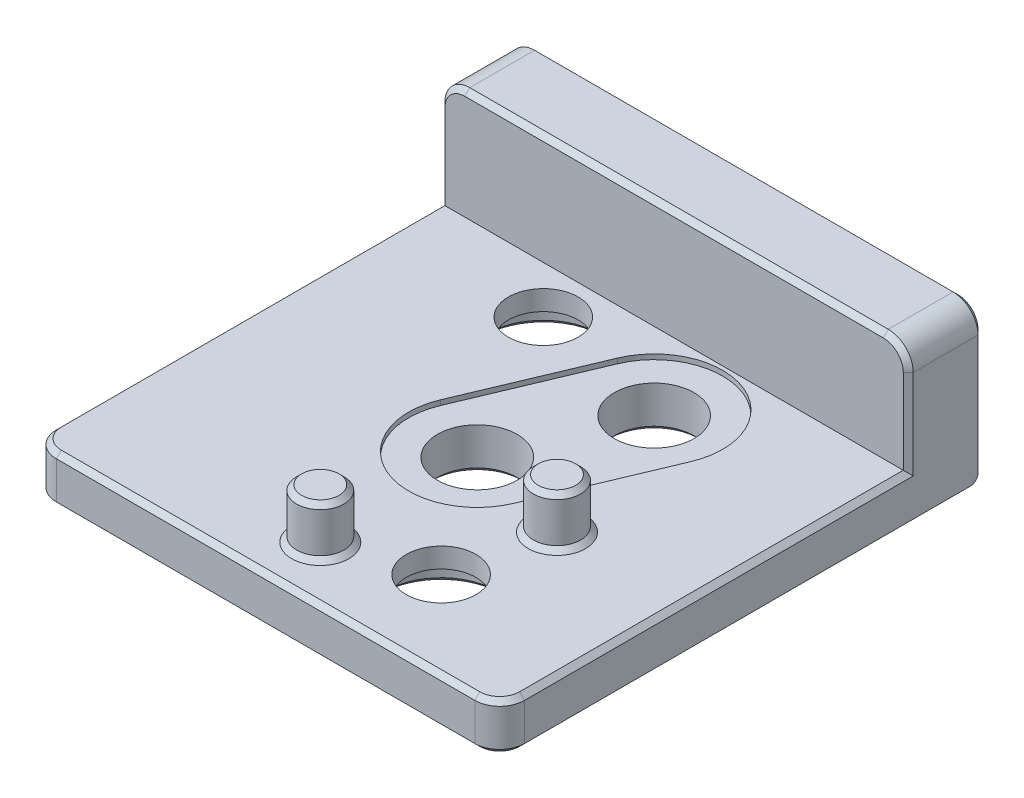
from build123d import *

# Parameters (mm, degrees)
SKETCH1_W           = 19.4
SKETCH1_H           = 1.9
SKETCH1_W_2         = 3
SKETCH1_H_2         = 4.4
BOSS_EXTRUDE1_DEPTH = 9.4
SKETCH2_R           = 1.6
SKETCH2_R_2         = 1.4
CUT_EXTRUDE1_DEPTH  = 23.001818107
CUT_EXTRUDE2_DEPTH  = 0.2
SKETCH4_R           = 2.25
CUT_EXTRUDE3_DEPTH  = 1.1
FILLET1_R           = 1
SKETCH5_R           = 0.95
BOSS_EXTRUDE2_DEPTH = 2
FILLET4_R           = 0.5
CHAMFER1_SIZE       = 0.2


with BuildPart() as part:
    # Sketch1 → Boss-Extrude1 (new, symmetric)
    with BuildSketch(Plane(origin=(0, 0, 0), x_dir=(0, 0, -1), z_dir=(1, 0, 0))):
        with Locations((9.7, -0.95)):
            Rectangle(SKETCH1_W, SKETCH1_H)
        with Locations((17.9, 2.2)):
            Rectangle(SKETCH1_W_2, SKETCH1_H_2)
    extrude(amount=BOSS_EXTRUDE1_DEPTH, both=True)

    # Sketch2 → Cut-Extrude1 (cut, through all)
    with BuildSketch(Plane(origin=(0, 0, 0), x_dir=(1, 0, 0), z_dir=(0, 1, 0))):
        with Locations(Location((0, 8.5, 0), (0, 0, 270))):
            Circle(SKETCH2_R)
        with Locations(Location((2.1, 13.5, 0), (0, 0, 270))):
            Circle(SKETCH2_R)
        with Locations(Location((3.55, 3.5, 0), (0, 0, 270))):
            Circle(SKETCH2_R_2)
        with Locations(Location((-3.35, 14.5, 0), (0, 0, 270))):
            Circle(SKETCH2_R_2)
    extrude(amount=-CUT_EXTRUDE1_DEPTH, mode=Mode.SUBTRACT)

    # Sketch3 → Cut-Extrude2 (cut)
    with BuildSketch(Plane(origin=(0, 0, 0), x_dir=(1, 0, 0), z_dir=(0, 1, 0))):
        with BuildLine():
            Line((-2.53545079, 9.564889332), (-0.43545079, 14.564889332))
            ThreePointArc((-0.43545079, 14.564889332), (3.164889332, 16.03545079), (4.63545079, 12.435110668))
            Line((4.63545079, 12.435110668), (2.53545079, 7.435110668))
            ThreePointArc((2.53545079, 7.435110668), (-1.064889332, 5.96454921), (-2.53545079, 9.564889332))
        make_face()
    extrude(amount=-CUT_EXTRUDE2_DEPTH, mode=Mode.SUBTRACT)

    # Sketch4 → Cut-Extrude3 (cut)
    with BuildSketch(Plane.XZ.offset(1.9)):
        with Locations(Location((-3.35, -14.5, 0), (0, 0, 270))):
            Circle(SKETCH4_R)
        with Locations(Location((3.55, -3.5, 0), (0, 0, 270))):
            Circle(SKETCH4_R)
    extrude(amount=-CUT_EXTRUDE3_DEPTH, mode=Mode.SUBTRACT)

    # Fillet1
    fillet1_edges = [part.edges().sort_by_distance(p)[0] for p in [
        (9.4, 4.4, -17.9),
        (9.4, -0.95, 0),
        (-9.4, -0.95, 0),
        (-9.4, 4.4, -17.9),
    ]]
    fillet(fillet1_edges, radius=FILLET1_R)

    # Sketch5 → Boss-Extrude2 (add)
    with BuildSketch(Plane(origin=(0, 0, 0), x_dir=(1, 0, 0), z_dir=(0, 1, 0))):
        with Locations(Location((0, 2.2, 0), (0, 0, 270))):
            Circle(SKETCH5_R)
        with Locations(Location((4.4, 7.3, 0), (0, 0, 270))):
            Circle(SKETCH5_R)
    extrude(amount=BOSS_EXTRUDE2_DEPTH)

    # Fillet4
    fillet4_edges = [part.edges().sort_by_distance(p)[0] for p in [
        (0, -1.9, -19.4),
    ]]
    fillet(fillet4_edges, radius=FILLET4_R)

    # Chamfer1
    chamfer1_edges = [part.edges().sort_by_distance(p)[0] for p in [
        (4.4, 0, -8.25),
        (4.4, 2, -8.25),
        (-9.4, -1.753553391, -19.253553391),
        (9.4, -1.753553391, -19.253553391),
        (9.4, 1.7, -16.4),
        (2.1, -1.9, -15.1),
        (0, -1.9, -10.1),
        (-3.35, -1.9, -12.25),
        (3.55, -1.9, -1.25),
        (0, 4.4, -16.4),
        (0, 4.4, -19.4),
        (9.107106781, 4.107106781, -16.4),
        (-9.107106781, 4.107106781, -16.4),
        (-9.4, 1, -19.4),
        (-9.4, -1.9, -9.95),
        (-9.4, 0, -8.7),
        (9.4, 1, -19.4),
        (9.107106781, 4.107106781, -19.4),
        (-9.107106781, 4.107106781, -19.4),
        (9.4, 0, -8.7),
        (9.4, -1.9, -9.95),
        (0, -1.9, 0),
        (0, 0, 0),
        (9.107106781, -1.9, -0.292893219),
        (-9.107106781, -1.9, -0.292893219),
        (9.107106781, 0, -0.292893219),
        (-9.107106781, 0, -0.292893219),
        (-9.4, 1.7, -16.4),
        (0, 0, -3.15),
        (0, 2, -3.15),
    ]]
    chamfer(chamfer1_edges, length=CHAMFER1_SIZE)


solid = part.part
